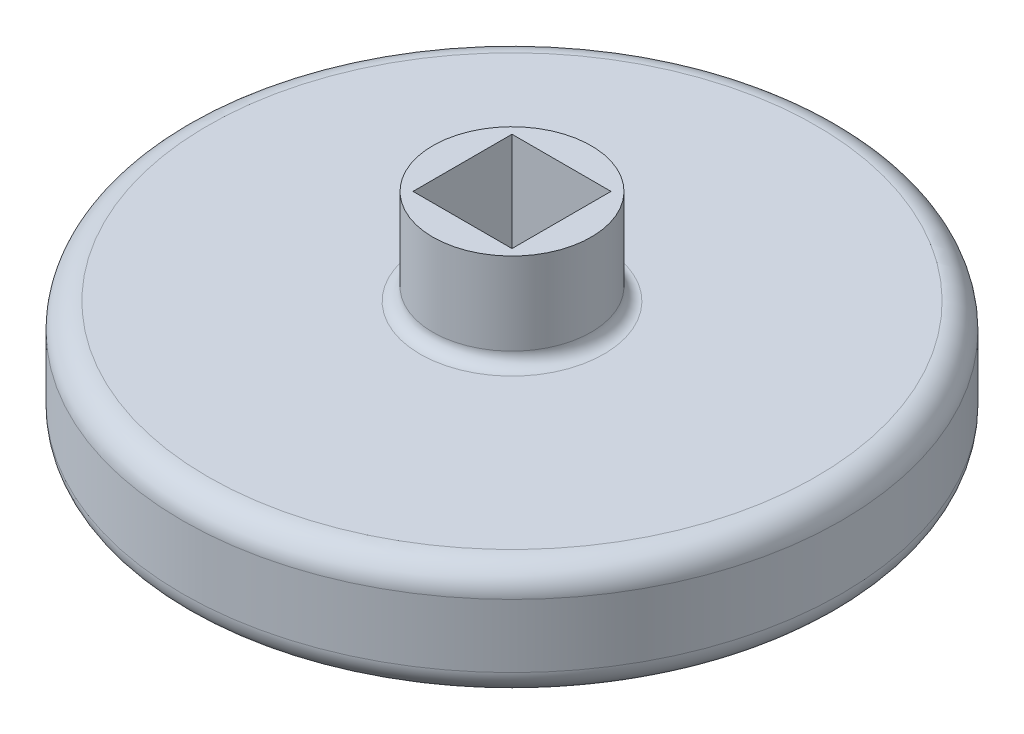
from build123d import *

# Parameters (mm, degrees)
SKETCH1_R                = 33.02
BOSS_EXTRUDE1_DEPTH      = 11.43
FILLET1_R                = 2.54
BOSS_EXTRUDE2_DEPTH      = 9.525
BOSS_EXTRUDE2_DEPTH_BACK = 20.955
SKETCH3_R                = 7.9375
FILLET2_R                = 1.27
CUT_EXTRUDE1_DEPTH       = 52.183521094
CUT_EXTRUDE1_DEPTH_BACK  = 52.183521094
SKETCH2_W                = 9.921875
SKETCH2_H                = 9.921875


with BuildPart() as part:
    # Sketch1 → Boss-Extrude1 (new body)
    with BuildSketch(Plane(origin=(0, 0, 0), x_dir=(1, 0, 0), z_dir=(0, 1, 0))):
        with Locations(Location((0, 0, 0), (0, 0, 270))):
            Circle(SKETCH1_R)
    extrude(amount=BOSS_EXTRUDE1_DEPTH)

    # Fillet1
    fillet1_edges = [part.edges().sort_by_distance(p)[0] for p in [
        (0, 0, -33.02),
        (0, 11.43, -33.02),
    ]]
    fillet(fillet1_edges, radius=FILLET1_R)

    # Sketch3 → Boss-Extrude2 (add, two sides: drawn at the far end of the back side and taken through both)
    with BuildSketch(Plane(origin=(0, 11.43, 0), x_dir=(1, 0, 0), z_dir=(0, 1, 0)).offset(-BOSS_EXTRUDE2_DEPTH_BACK)):
        with Locations(Location((0, 0, 0), (0, 0, 270))):
            Circle(SKETCH3_R)
    extrude(amount=BOSS_EXTRUDE2_DEPTH + BOSS_EXTRUDE2_DEPTH_BACK)

    # Fillet2
    fillet2_edges = [part.edges().sort_by_distance(p)[0] for p in [
        (0, 11.43, -7.9375),
        (0, 0, -7.9375),
    ]]
    fillet(fillet2_edges, radius=FILLET2_R)

    # Sketch2 → Cut-Extrude1 (cut, two sides: drawn at the far end of the back side and taken through both)
    with BuildSketch(Plane(origin=(0, 11.43, 0), x_dir=(1, 0, 0), z_dir=(0, 1, 0)).offset(-CUT_EXTRUDE1_DEPTH_BACK)):
        Rectangle(SKETCH2_W, SKETCH2_H)
    extrude(amount=CUT_EXTRUDE1_DEPTH + CUT_EXTRUDE1_DEPTH_BACK, mode=Mode.SUBTRACT)


solid = part.part
